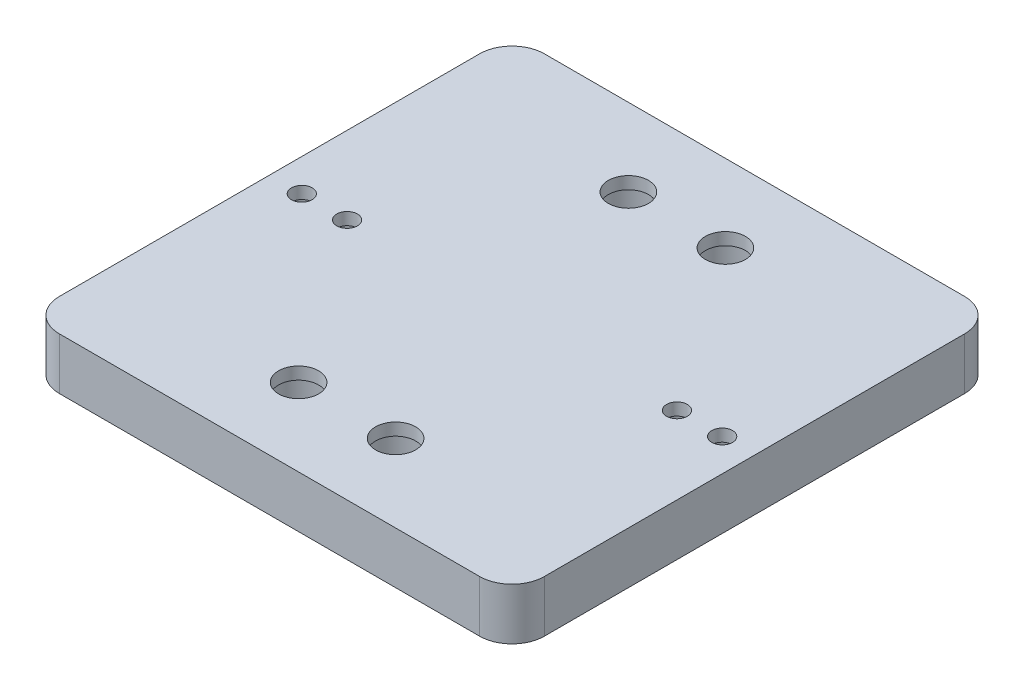
from build123d import *
from build123d.topology import SkipClean

# Parameters (mm, degrees)
SKETCH1_W           = 75
SKETCH1_H           = 75
SKETCH1_R           = 1.6
SKETCH1_R_2         = 3.1
BOSS_EXTRUDE1_DEPTH = 4
BOSS_EXTRUDE2_START = 4
SKETCH3_W           = 75
SKETCH3_H           = 75
SKETCH3_R           = 3.1
SKETCH3_R_2         = 1.6
BOSS_EXTRUDE2_DEPTH = 4
SKETCH5_R           = 5.05
SKETCH5_R_2         = 2.95
CUT_EXTRUDE1_DEPTH  = 6.1
FILLET2_R           = 5


with BuildPart() as part:
    # Sketch1 → Boss-Extrude1 (new body)
    with BuildSketch(Plane(origin=(0, 0, 0), x_dir=(1, 0, 0), z_dir=(0, 1, 0))):
        Rectangle(SKETCH1_W, SKETCH1_H)
        with Locations(Location((-32.5, 0, 0), (0, 0, 270))):
            Circle(SKETCH1_R, mode=Mode.SUBTRACT)
        with Locations(Location((-25.5, 0, 0), (0, 0, 90))):
            Circle(SKETCH1_R, mode=Mode.SUBTRACT)
        with Locations(Location((25.5, 0, 0), (0, 0, 270))):
            Circle(SKETCH1_R, mode=Mode.SUBTRACT)
        with Locations(Location((32.5, 0, 0), (0, 0, 90))):
            Circle(SKETCH1_R, mode=Mode.SUBTRACT)
        with Locations(Location((-7.5, -25.5, 0), (0, 0, 270))):
            Circle(SKETCH1_R_2, mode=Mode.SUBTRACT)
        with Locations(Location((7.5, -25.5, 0), (0, 0, 90))):
            Circle(SKETCH1_R_2, mode=Mode.SUBTRACT)
        with Locations(Location((7.5, 25.5, 0), (0, 0, 270))):
            Circle(SKETCH1_R_2, mode=Mode.SUBTRACT)
        with Locations(Location((-7.5, 25.5, 0), (0, 0, 90))):
            Circle(SKETCH1_R_2, mode=Mode.SUBTRACT)
    extrude(amount=BOSS_EXTRUDE1_DEPTH)

    # Sketch3 → Boss-Extrude2 (add)
    with SkipClean():  # the faces are left unmerged after this step: merging them gives an invalid solid
        with BuildSketch(Plane.XZ.offset(BOSS_EXTRUDE2_START)):
            Rectangle(SKETCH3_W, SKETCH3_H)
            with Locations(Location((-7.5, -25.5, 0), (0, 0, 270))):
                Circle(SKETCH3_R, mode=Mode.SUBTRACT)
            with Locations(Location((7.5, -25.5, 0), (0, 0, 270))):
                Circle(SKETCH3_R, mode=Mode.SUBTRACT)
            with Locations(Location((32.5, 0, 0), (0, 0, 270))):
                Circle(SKETCH3_R_2, mode=Mode.SUBTRACT)
            with Locations(Location((25.5, 0, 0), (0, 0, 270))):
                Circle(SKETCH3_R_2, mode=Mode.SUBTRACT)
            with Locations(Location((7.5, 25.5, 0), (0, 0, 270))):
                Circle(SKETCH3_R, mode=Mode.SUBTRACT)
            with Locations(Location((-7.5, 25.5, 0), (0, 0, 270))):
                Circle(SKETCH3_R, mode=Mode.SUBTRACT)
            with Locations(Location((-25.5, 0, 0), (0, 0, 270))):
                Circle(SKETCH3_R_2, mode=Mode.SUBTRACT)
            with Locations(Location((-32.5, 0, 0), (0, 0, 270))):
                Circle(SKETCH3_R_2, mode=Mode.SUBTRACT)
        extrude(amount=-BOSS_EXTRUDE2_DEPTH)

    # Sketch5 → Cut-Extrude1 (cut)
    with BuildSketch(Plane.XZ.offset(4)):
        with Locations(Location((-7.5, -25.5, 0), (0, 0, 270))):
            Circle(SKETCH5_R)
        with Locations(Location((7.5, -25.5, 0), (0, 0, 90))):
            Circle(SKETCH5_R)
        with Locations(Location((7.5, 25.5, 0), (0, 0, 270))):
            Circle(SKETCH5_R)
        with Locations(Location((-7.5, 25.5, 0), (0, 0, 90))):
            Circle(SKETCH5_R)
        with Locations(Location((-32.5, 0, 0), (0, 0, 270))):
            Circle(SKETCH5_R_2)
        with Locations(Location((-25.5, 0, 0), (0, 0, 270))):
            Circle(SKETCH5_R_2)
        with Locations(Location((25.5, 0, 0), (0, 0, 90))):
            Circle(SKETCH5_R_2)
        with Locations(Location((32.5, 0, 0), (0, 0, 90))):
            Circle(SKETCH5_R_2)
    extrude(amount=-CUT_EXTRUDE1_DEPTH, mode=Mode.SUBTRACT)

    # Fillet2
    fillet2_edges = [part.edges().sort_by_distance(p)[0] for p in [
        (-37.5, 0, -37.5),
        (37.5, 0, -37.5),
        (37.5, 0, 37.5),
        (-37.5, 0, 37.5),
    ]]
    fillet(fillet2_edges, radius=FILLET2_R)


solid = part.part
